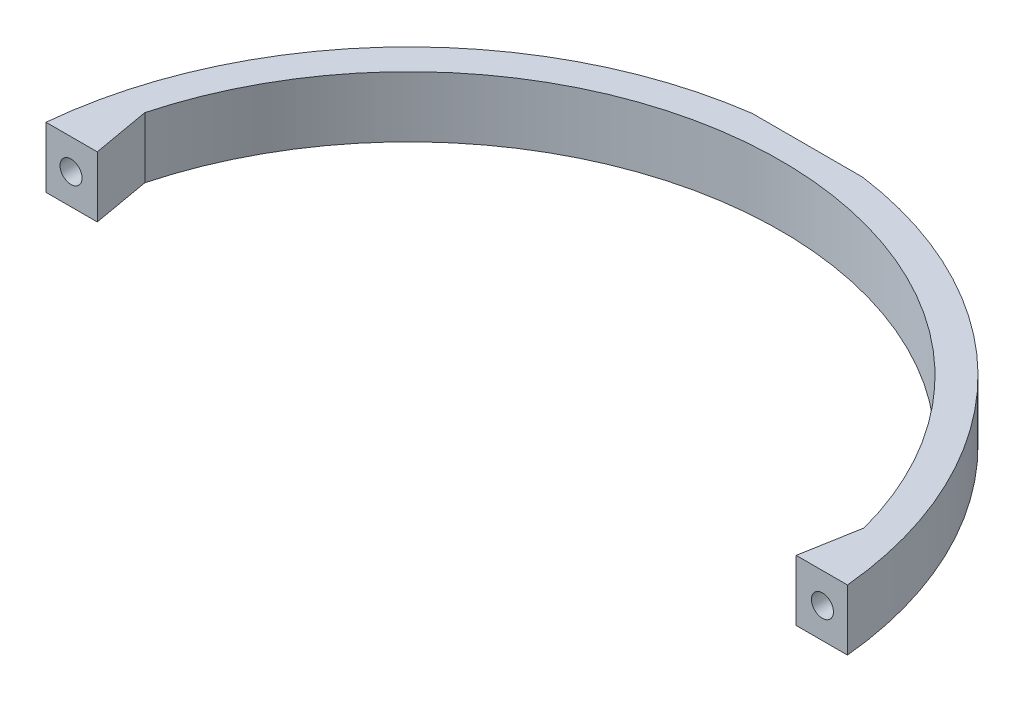
from build123d import *

# Parameters (mm, degrees)
BOSS_EXTRUDE1_DEPTH = 8
SKETCH4_R           = 3.025
CUT_EXTRUDE3_DEPTH  = 2.1
SKETCH5_R           = 1.45
CUT_EXTRUDE4_DEPTH  = 6.5
SKETCH6_R           = 1.75
CUT_EXTRUDE5_DEPTH  = 0.41


with BuildPart() as part:
    # Sketch1 → Boss-Extrude1 (new body)
    with BuildSketch(Plane(origin=(0, 0, 0), x_dir=(1, 0, 0), z_dir=(0, 1, 0))):
        with BuildLine():
            Line((52.763623833, 5), (46.013623833, 5))
            Line((46.013623833, 5), (47.353145997, 12.596807697))
            ThreePointArc((47.353145997, 12.596807697), (0, 49), (-47.353145997, 12.596807697))
            Line((-47.353145997, 12.596807697), (-46.013623833, 5))
            Line((-46.013623833, 5), (-52.763623833, 5))
            ThreePointArc((-52.763623833, 5), (-38.273476153, 36.66252887), (-7.262919523, 52.5))
            Line((-7.262919523, 52.5), (7.262919523, 52.5))
            ThreePointArc((7.262919523, 52.5), (38.273476153, 36.66252887), (52.763623833, 5))
        make_face()
    extrude(amount=BOSS_EXTRUDE1_DEPTH)

    # Sketch4 → Cut-Extrude3 (cut)
    with BuildSketch(Plane(origin=(0, 0, -52.5), x_dir=(-1, 0, 0), z_dir=(0, 0, -1))):
        with Locations((0, 4)):
            Circle(SKETCH4_R)
    extrude(amount=-CUT_EXTRUDE3_DEPTH, mode=Mode.SUBTRACT)

    # Sketch5 → Cut-Extrude4 (cut)
    with BuildSketch(Plane.XY.offset(-5)):
        with Locations((-49.47, 4)):
            Circle(SKETCH5_R)
    cut_extrude4 = extrude(amount=-CUT_EXTRUDE4_DEPTH, mode=Mode.SUBTRACT)

    # Mirror1: Cut-Extrude4 across plane
    add(cut_extrude4.mirror(Plane(origin=(0, 0, 0), x_dir=(0, 0, 1), z_dir=(1, 0, 0))), mode=Mode.SUBTRACT)

    # Sketch6 → Cut-Extrude5 (cut)
    with BuildSketch(Plane(origin=(0, 0, -50.4), x_dir=(-1, 0, 0), z_dir=(0, 0, -1))):
        with Locations((0, 4)):
            Circle(SKETCH6_R)
    extrude(amount=-CUT_EXTRUDE5_DEPTH, mode=Mode.SUBTRACT)


solid = part.part
